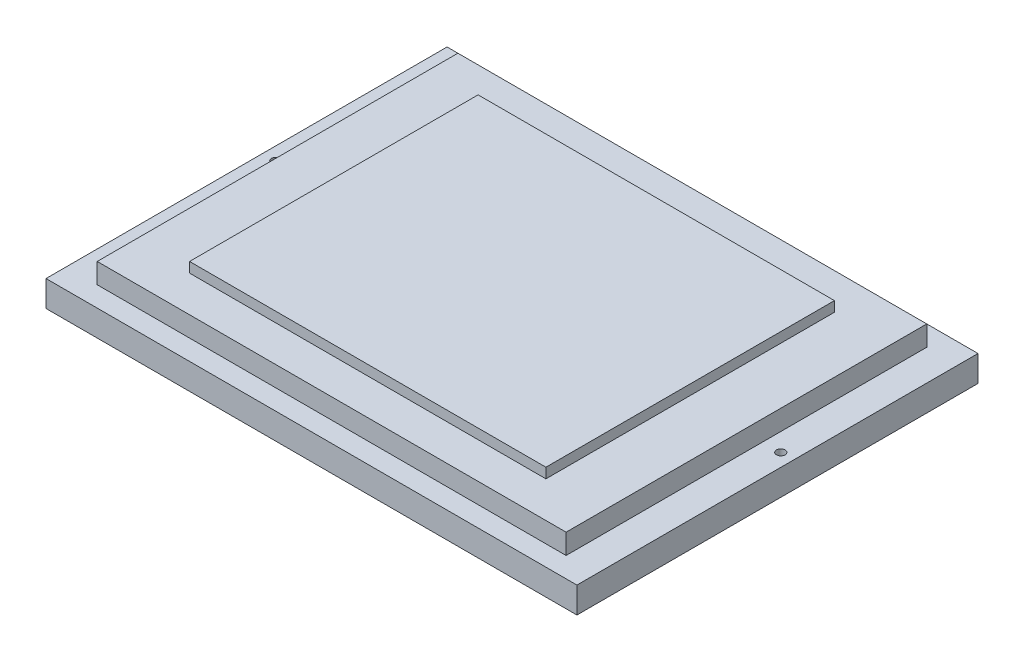
from build123d import *

# Parameters (mm, degrees)
SKETCH1_W           = 368
SKETCH1_H           = 278
BOSS_EXTRUDE1_DEPTH = 39
SKETCH2_W           = 368
SKETCH2_H           = 278
SKETCH2_W_2         = 325
SKETCH2_H_2         = 250
CUT_EXTRUDE1_DEPTH  = 21
SKETCH3_W           = 325
SKETCH3_H           = 250
SKETCH3_W_2         = 247
SKETCH3_H_2         = 200
CUT_EXTRUDE2_DEPTH  = 7
SKETCH4_R           = 3
CUT_EXTRUDE3_DEPTH  = 59


with BuildPart() as part:
    # Sketch1 → Boss-Extrude1 (new body)
    with BuildSketch(Plane(origin=(0, 0, 0), x_dir=(1, 0, 0), z_dir=(0, 1, 0))):
        with Locations((184, 139)):
            Rectangle(SKETCH1_W, SKETCH1_H)
    extrude(amount=-BOSS_EXTRUDE1_DEPTH)

    # Sketch2 → Cut-Extrude1 (cut)
    with BuildSketch(Plane(origin=(0, 0, 0), x_dir=(1, 0, 0), z_dir=(0, 1, 0))):
        with Locations((184, 139)):
            Rectangle(SKETCH2_W, SKETCH2_H)
        with Locations((184, 139)):
            Rectangle(SKETCH2_W_2, SKETCH2_H_2, mode=Mode.SUBTRACT)
    extrude(amount=-CUT_EXTRUDE1_DEPTH, mode=Mode.SUBTRACT)

    # Sketch3 → Cut-Extrude2 (cut)
    with BuildSketch(Plane(origin=(0, 0, 0), x_dir=(1, 0, 0), z_dir=(0, 1, 0))):
        with Locations((184, 139)):
            Rectangle(SKETCH3_W, SKETCH3_H)
        with Locations((184, 139)):
            Rectangle(SKETCH3_W_2, SKETCH3_H_2, mode=Mode.SUBTRACT)
    extrude(amount=-CUT_EXTRUDE2_DEPTH, mode=Mode.SUBTRACT)

    # Sketch4 → Cut-Extrude3 (cut)
    with BuildSketch(Plane(origin=(0, 0, 0), x_dir=(1, 0, 0), z_dir=(0, 1, 0))):
        with Locations(Location((9, 150.3, 0), (0, 0, 270))):
            Circle(SKETCH4_R)
        with Locations(Location((359, 150.3, 0), (0, 0, 270))):
            Circle(SKETCH4_R)
    extrude(amount=-CUT_EXTRUDE3_DEPTH, mode=Mode.SUBTRACT)


solid = part.part
